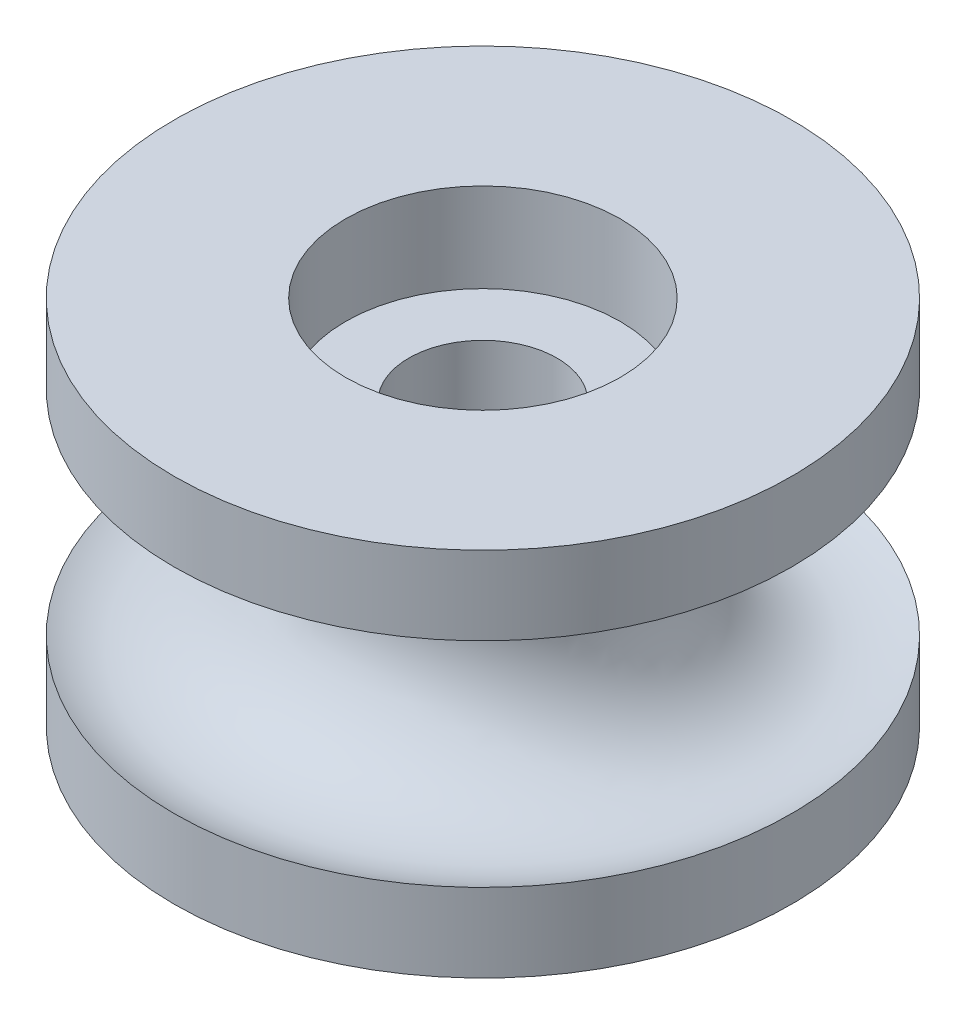
from build123d import *

# Parameters (mm, degrees)
BOSS_EXTRUDE1_DEPTH      = 15
BOSS_EXTRUDE1_DEPTH_BACK = 15
SKETCH1_R                = 25
SKETCH1_R_2              = 6
SKETCH2_R                = 9.525
CUT_EXTRUDE1_START       = 15
SKETCH3_R                = 11.125
CUT_EXTRUDE1_DEPTH       = 7.2
CUT_EXTRUDE2_START       = -7.8
SKETCH4_R                = 11.125
CUT_EXTRUDE2_DEPTH       = 7.2


with BuildPart() as part:
    # Sketch1 → Boss-Extrude1 (new, two sides: drawn at the far end of the back side and taken through both)
    with BuildSketch(Plane(origin=(0, 0, 0), x_dir=(1, 0, 0), z_dir=(0, 1, 0)).offset(-BOSS_EXTRUDE1_DEPTH_BACK)):
        with Locations(Location((0, 0, 0), (0, 0, 270))):
            Circle(SKETCH1_R)
        with Locations(Location((0, 0, 0), (0, 0, 270))):
            Circle(SKETCH1_R_2, mode=Mode.SUBTRACT)
    extrude(amount=BOSS_EXTRUDE1_DEPTH + BOSS_EXTRUDE1_DEPTH_BACK)

    # Sketch2 → Cut-Revolve1 (revolve, cut)
    with BuildSketch(Plane(origin=(0, 0, 0), x_dir=(0, 0, -1), z_dir=(1, 0, 0)), mode=Mode.PRIVATE) as cut_revolve1_sk:
        with Locations((21, 0)):
            Circle(SKETCH2_R)
    revolve(cut_revolve1_sk.sketch.rotate(Axis((0, 0, 0), (0, 1, 0)), 180), axis=Axis((0, 0, 0), (0, 1, 0)), mode=Mode.SUBTRACT)

    # Sketch3 → Cut-Extrude1 (cut)
    with BuildSketch(Plane(origin=(0, 0, 0), x_dir=(1, 0, 0), z_dir=(0, 1, 0)).offset(CUT_EXTRUDE1_START)):
        with Locations(Location((0, 0, 0), (0, 0, 270))):
            Circle(SKETCH3_R)
    extrude(amount=-CUT_EXTRUDE1_DEPTH, mode=Mode.SUBTRACT)

    # Sketch4 → Cut-Extrude2 (cut)
    with BuildSketch(Plane(origin=(0, 0, 0), x_dir=(1, 0, 0), z_dir=(0, 1, 0)).offset(CUT_EXTRUDE2_START)):
        with Locations(Location((0, 0, 0), (0, 0, 270))):
            Circle(SKETCH4_R)
    extrude(amount=-CUT_EXTRUDE2_DEPTH, mode=Mode.SUBTRACT)


solid = part.part
